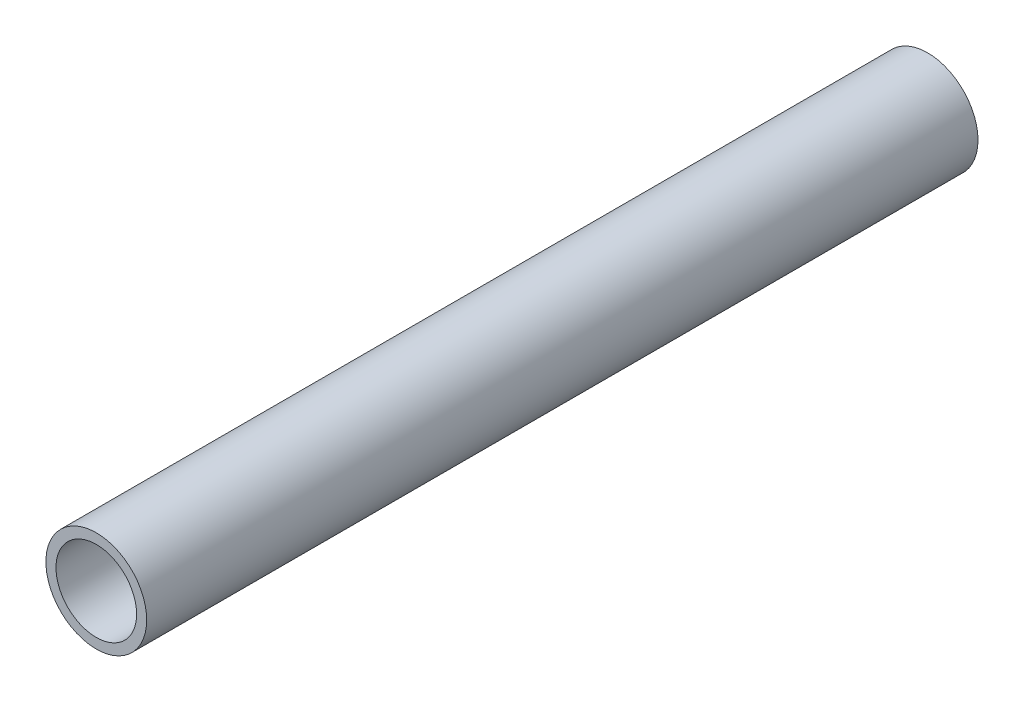
from build123d import *

# Parameters (mm, degrees)
SKETCH_1_R      = 10
SKETCH_1_R_2    = 8
EXTRUDE_1_DEPTH = 165


with BuildPart() as part:
    # 草图1 → 凸台-拉伸1 (new body)
    with BuildSketch(Plane.XY):
        Circle(SKETCH_1_R)
        Circle(SKETCH_1_R_2, mode=Mode.SUBTRACT)
    extrude(amount=EXTRUDE_1_DEPTH)


solid = part.part
